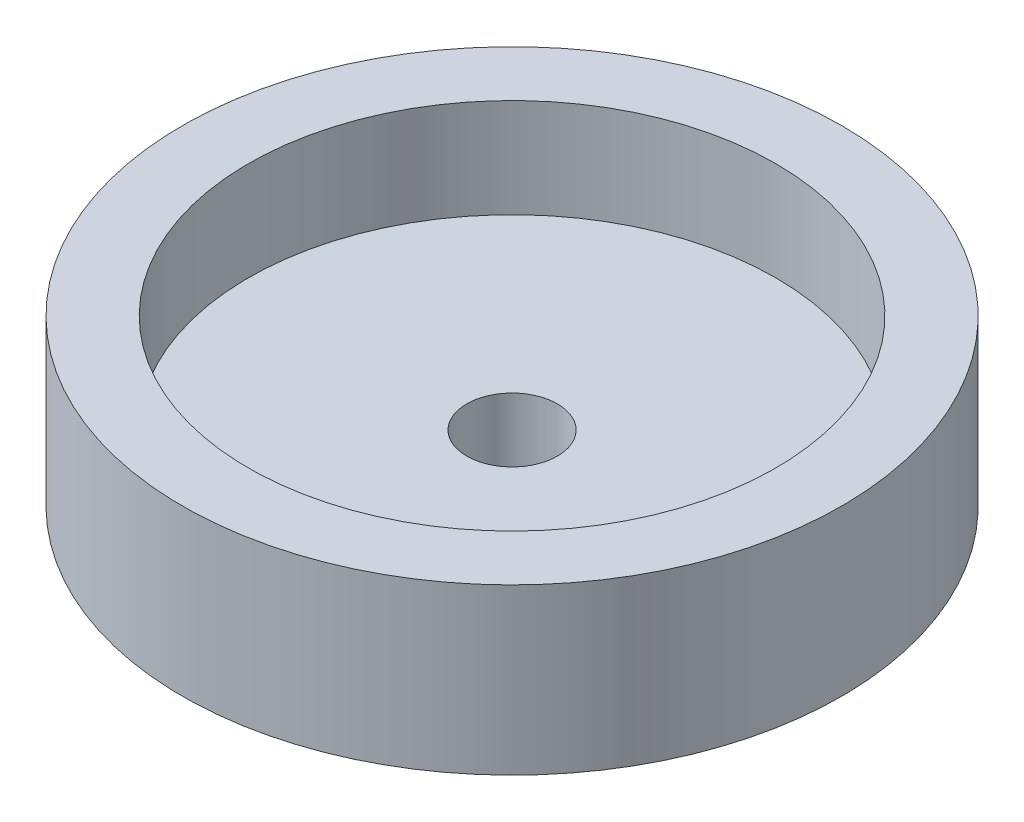
from build123d import *

# Parameters (mm, degrees)
SKETCH1_W            = 16
SKETCH1_H            = 4
M5_CLEARANCE_HOLE1_D = 5.5


with BuildPart() as part:
    # Sketch1 → Revolve1 (revolve)
    with BuildSketch(Plane.XY, mode=Mode.PRIVATE) as revolve1_sk:
        with Locations((-8, 2)):
            Rectangle(SKETCH1_W, SKETCH1_H)
        Polygon((-20, 0), (-16, 0), (-16, 4), (-16, 10), (-20, 10), align=None)
    revolve(revolve1_sk.sketch.rotate(Axis((0, 0, 0), (0, 1, 0)), 270), axis=Axis((0, 0, 0), (0, 1, 0)))

    # M5 Clearance Hole1 (through all)
    with Locations(Plane(origin=(0, 4, 0), x_dir=(1, 0, 0), z_dir=(0, 1, 0))):
        with Locations((0, 0)):
            Hole(M5_CLEARANCE_HOLE1_D / 2)


solid = part.part
